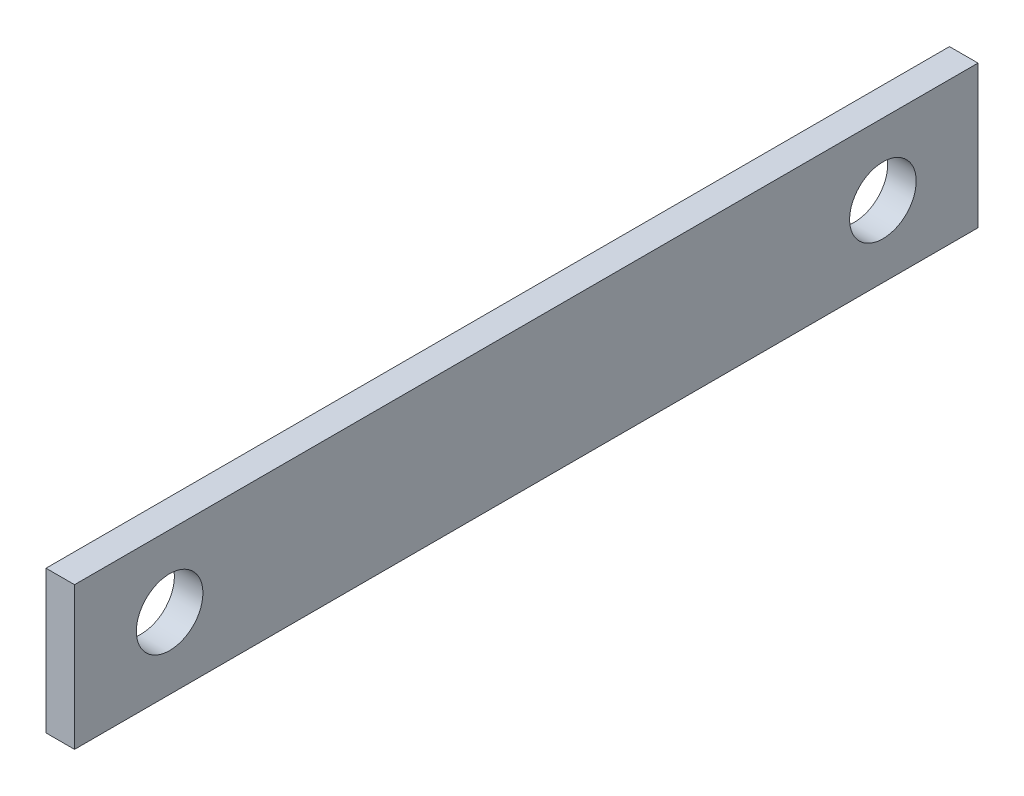
from build123d import *

# Parameters (mm, degrees)
SKETCH1_W           = 190
SKETCH1_H           = 30
SKETCH1_R           = 7
BOSS_EXTRUDE1_DEPTH = 6


with BuildPart() as part:
    # Sketch1 → Boss-Extrude1 (new body)
    with BuildSketch(Plane(origin=(0, 0, 0), x_dir=(0, 0, -1), z_dir=(1, 0, 0))):
        Rectangle(SKETCH1_W, SKETCH1_H)
        with Locations((-75, 0)):
            Circle(SKETCH1_R, mode=Mode.SUBTRACT)
        with Locations((75, 0)):
            Circle(SKETCH1_R, mode=Mode.SUBTRACT)
    extrude(amount=BOSS_EXTRUDE1_DEPTH)


solid = part.part
